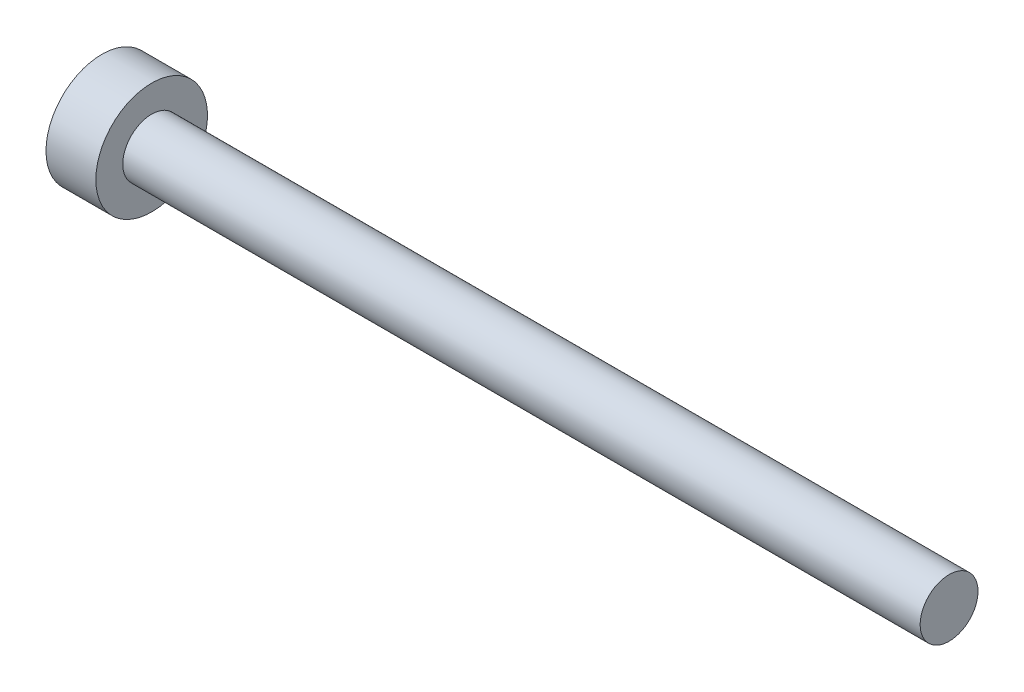
from build123d import *

# Parameters (mm, degrees)
IZIM1_R                     = 1.45
Y_KSEKLIK_EKSTR_ZYON1_DEPTH = 40
IZIM2_R                     = 2.8
Y_KSEKLIK_EKSTR_ZYON2_DEPTH = 2.5
KES_EKSTR_ZYON1_DEPTH       = 2


with BuildPart() as part:
    # Çizim1 → Yükseklik-Ekstrüzyon1 (new body)
    with BuildSketch(Plane(origin=(0, 0, 0), x_dir=(0, 0, -1), z_dir=(1, 0, 0))):
        Circle(IZIM1_R)
    extrude(amount=Y_KSEKLIK_EKSTR_ZYON1_DEPTH)

    # Çizim2 → Yükseklik-Ekstrüzyon2 (add)
    with BuildSketch(Plane.ZY):
        Circle(IZIM2_R)
    extrude(amount=Y_KSEKLIK_EKSTR_ZYON2_DEPTH)

    # Çizim3 → Kes-Ekstrüzyon1 (cut)
    with BuildSketch(Plane.ZY.offset(2.5)):
        Polygon((0.866025404, -1.5), (1.732050808, 0), (0.866025404, 1.5), (-0.866025404, 1.5), (-1.732050808, 0), (-0.866025404, -1.5), align=None)
    extrude(amount=-KES_EKSTR_ZYON1_DEPTH, mode=Mode.SUBTRACT)


solid = part.part
